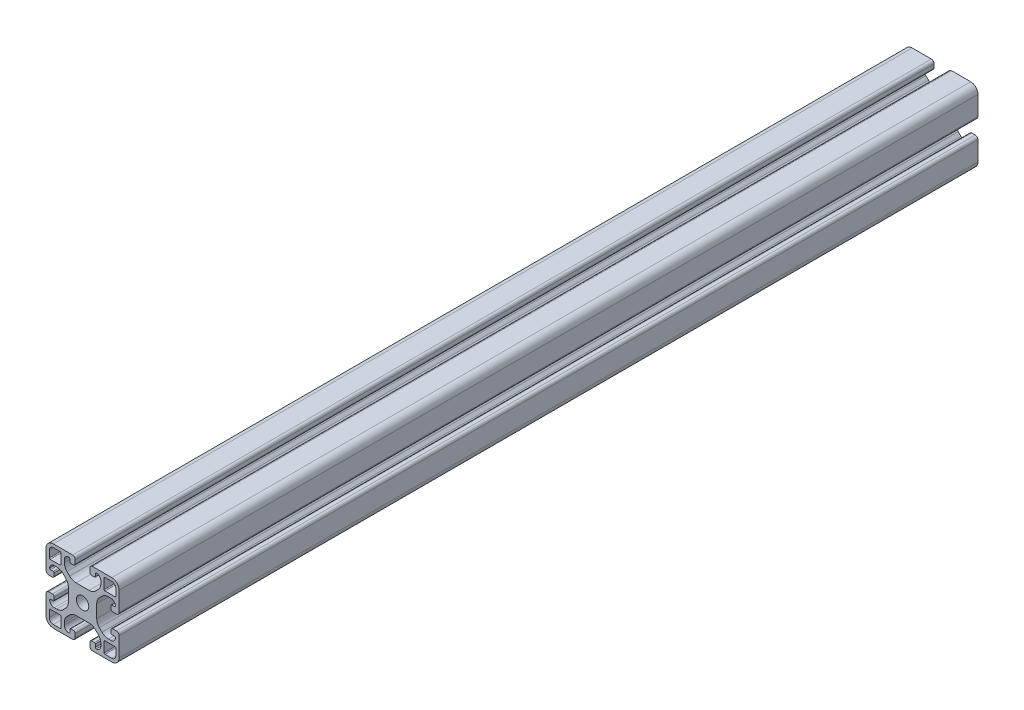
from build123d import *

# Parameters (mm, degrees)
ESQUISSE1_R        = 3.4
BOSS_EXTRU_1_DEPTH = 470


with BuildPart() as part:
    # Esquisse1 → Boss.-Extru.1 (new body)
    with BuildSketch(Plane(origin=(0, 0, -30), x_dir=(-1, 0, 0), z_dir=(0, 0, -1))):
        with BuildLine():
            Line((-4.5, 15), (-4.5, 13.5))
            ThreePointArc((-4.5, 13.5), (-4.353553391, 13.146446609), (-4, 13))
            Line((-4, 13), (-2.5, 13))
            ThreePointArc((-2.5, 13), (-2.146446609, 12.853553391), (-2, 12.5))
            ThreePointArc((-2, 12.5), (-2.732233047, 10.732233047), (-4.5, 10))
            Line((-4.5, 10), (-5.807611845, 10))
            ThreePointArc((-5.807611845, 10), (-7.721029006, 10.380602337), (-9.343145751, 11.464466094))
            Line((-9.343145751, 11.464466094), (-10.785533906, 12.906854249))
            ThreePointArc((-10.785533906, 12.906854249), (-11.869397663, 14.528970994), (-12.25, 16.442388155))
            Line((-12.25, 16.442388155), (-12.25, 23.557611845))
            ThreePointArc((-12.25, 23.557611845), (-11.869397663, 25.471029006), (-10.785533906, 27.093145751))
            Line((-10.785533906, 27.093145751), (-9.343145751, 28.535533906))
            ThreePointArc((-9.343145751, 28.535533906), (-7.721029006, 29.619397663), (-5.807611845, 30))
            Line((-5.807611845, 30), (-4.5, 30))
            ThreePointArc((-4.5, 30), (-2.732233047, 29.267766953), (-2, 27.5))
            ThreePointArc((-2, 27.5), (-2.146446609, 27.146446609), (-2.5, 27))
            Line((-2.5, 27), (-4, 27))
            ThreePointArc((-4, 27), (-4.353553391, 26.853553391), (-4.5, 26.5))
            Line((-4.5, 26.5), (-4.5, 25))
            ThreePointArc((-4.5, 25), (-4.207106781, 24.292893219), (-3.5, 24))
            Line((-3.5, 24), (-1.5, 24))
            ThreePointArc((-1.5, 24), (-0.439339828, 24.439339828), (0, 25.5))
            Line((0, 25.5), (0, 36))
            ThreePointArc((0, 36), (-1.171572875, 38.828427125), (-4, 40))
            Line((-4, 40), (-14.5, 40))
            ThreePointArc((-14.5, 40), (-15.560660172, 39.560660172), (-16, 38.5))
            Line((-16, 38.5), (-16, 36.5))
            ThreePointArc((-16, 36.5), (-15.707106781, 35.792893219), (-15, 35.5))
            Line((-15, 35.5), (-13.5, 35.5))
            ThreePointArc((-13.5, 35.5), (-13.146446609, 35.646446609), (-13, 36))
            Line((-13, 36), (-13, 37.5))
            ThreePointArc((-13, 37.5), (-12.853553391, 37.853553391), (-12.5, 38))
            ThreePointArc((-12.5, 38), (-10.732233047, 37.267766953), (-10, 35.5))
            Line((-10, 35.5), (-10, 34.192388155))
            ThreePointArc((-10, 34.192388155), (-10.380602337, 32.278970994), (-11.464466094, 30.656854249))
            Line((-11.464466094, 30.656854249), (-12.906854249, 29.214466094))
            ThreePointArc((-12.906854249, 29.214466094), (-14.528970994, 28.130602337), (-16.442388155, 27.75))
            Line((-16.442388155, 27.75), (-23.557611845, 27.75))
            ThreePointArc((-23.557611845, 27.75), (-25.471029006, 28.130602337), (-27.093145751, 29.214466094))
            Line((-27.093145751, 29.214466094), (-28.535533906, 30.656854249))
            ThreePointArc((-28.535533906, 30.656854249), (-29.619397663, 32.278970994), (-30, 34.192388155))
            Line((-30, 34.192388155), (-30, 35.5))
            ThreePointArc((-30, 35.5), (-29.267766953, 37.267766953), (-27.5, 38))
            ThreePointArc((-27.5, 38), (-27.146446609, 37.853553391), (-27, 37.5))
            Line((-27, 37.5), (-27, 36))
            ThreePointArc((-27, 36), (-26.853553391, 35.646446609), (-26.5, 35.5))
            Line((-26.5, 35.5), (-25, 35.5))
            ThreePointArc((-25, 35.5), (-24.292893219, 35.792893219), (-24, 36.5))
            Line((-24, 36.5), (-24, 38.5))
            ThreePointArc((-24, 38.5), (-24.439339828, 39.560660172), (-25.5, 40))
            Line((-25.5, 40), (-36, 40))
            ThreePointArc((-36, 40), (-38.828427125, 38.828427125), (-40, 36))
            Line((-40, 36), (-40, 25.5))
            ThreePointArc((-40, 25.5), (-39.560660172, 24.439339828), (-38.5, 24))
            Line((-38.5, 24), (-36.5, 24))
            ThreePointArc((-36.5, 24), (-35.792893219, 24.292893219), (-35.5, 25))
            Line((-35.5, 25), (-35.5, 26.5))
            ThreePointArc((-35.5, 26.5), (-35.646446609, 26.853553391), (-36, 27))
            Line((-36, 27), (-37.5, 27))
            ThreePointArc((-37.5, 27), (-37.853553391, 27.146446609), (-38, 27.5))
            ThreePointArc((-38, 27.5), (-37.267766953, 29.267766953), (-35.5, 30))
            Line((-35.5, 30), (-34.192388155, 30))
            ThreePointArc((-34.192388155, 30), (-32.278970994, 29.619397663), (-30.656854249, 28.535533906))
            Line((-30.656854249, 28.535533906), (-29.214466094, 27.093145751))
            ThreePointArc((-29.214466094, 27.093145751), (-28.130602337, 25.471029006), (-27.75, 23.557611845))
            Line((-27.75, 23.557611845), (-27.75, 16.442388155))
            ThreePointArc((-27.75, 16.442388155), (-28.130602337, 14.528970994), (-29.214466094, 12.906854249))
            Line((-29.214466094, 12.906854249), (-30.656854249, 11.464466094))
            ThreePointArc((-30.656854249, 11.464466094), (-32.278970994, 10.380602337), (-34.192388155, 10))
            Line((-34.192388155, 10), (-35.5, 10))
            ThreePointArc((-35.5, 10), (-37.267766953, 10.732233047), (-38, 12.5))
            ThreePointArc((-38, 12.5), (-37.853553391, 12.853553391), (-37.5, 13))
            Line((-37.5, 13), (-36, 13))
            ThreePointArc((-36, 13), (-35.646446609, 13.146446609), (-35.5, 13.5))
            Line((-35.5, 13.5), (-35.5, 15))
            ThreePointArc((-35.5, 15), (-35.792893219, 15.707106781), (-36.5, 16))
            Line((-36.5, 16), (-38.5, 16))
            ThreePointArc((-38.5, 16), (-39.560660172, 15.560660172), (-40, 14.5))
            Line((-40, 14.5), (-40, 4))
            ThreePointArc((-40, 4), (-38.828427125, 1.171572875), (-36, 0))
            Line((-36, 0), (-25.5, 0))
            ThreePointArc((-25.5, 0), (-24.439339828, 0.439339828), (-24, 1.5))
            Line((-24, 1.5), (-24, 3.5))
            ThreePointArc((-24, 3.5), (-24.292893219, 4.207106781), (-25, 4.5))
            Line((-25, 4.5), (-26.5, 4.5))
            ThreePointArc((-26.5, 4.5), (-26.853553391, 4.353553391), (-27, 4))
            Line((-27, 4), (-27, 2.5))
            ThreePointArc((-27, 2.5), (-27.146446609, 2.146446609), (-27.5, 2))
            ThreePointArc((-27.5, 2), (-29.267766953, 2.732233047), (-30, 4.5))
            Line((-30, 4.5), (-30, 5.807611845))
            ThreePointArc((-30, 5.807611845), (-29.619397663, 7.721029006), (-28.535533906, 9.343145751))
            Line((-28.535533906, 9.343145751), (-27.093145751, 10.785533906))
            ThreePointArc((-27.093145751, 10.785533906), (-25.471029006, 11.869397663), (-23.557611845, 12.25))
            Line((-23.557611845, 12.25), (-16.442388155, 12.25))
            ThreePointArc((-16.442388155, 12.25), (-14.528970994, 11.869397663), (-12.906854249, 10.785533906))
            Line((-12.906854249, 10.785533906), (-11.464466094, 9.343145751))
            ThreePointArc((-11.464466094, 9.343145751), (-10.380602337, 7.721029006), (-10, 5.807611845))
            Line((-10, 5.807611845), (-10, 4.5))
            ThreePointArc((-10, 4.5), (-10.732233047, 2.732233047), (-12.5, 2))
            ThreePointArc((-12.5, 2), (-12.853553391, 2.146446609), (-13, 2.5))
            Line((-13, 2.5), (-13, 4))
            ThreePointArc((-13, 4), (-13.146446609, 4.353553391), (-13.5, 4.5))
            Line((-13.5, 4.5), (-15, 4.5))
            ThreePointArc((-15, 4.5), (-15.707106781, 4.207106781), (-16, 3.5))
            Line((-16, 3.5), (-16, 1.5))
            ThreePointArc((-16, 1.5), (-15.560660172, 0.439339828), (-14.5, 0))
            Line((-14.5, 0), (-4, 0))
            ThreePointArc((-4, 0), (-1.171572875, 1.171572875), (0, 4))
            Line((0, 4), (0, 14.5))
            ThreePointArc((0, 14.5), (-0.439339828, 15.560660172), (-1.5, 16))
            Line((-1.5, 16), (-3.5, 16))
            ThreePointArc((-3.5, 16), (-4.207106781, 15.707106781), (-4.5, 15))
        make_face()
        with Locations((-20, 20)):
            Circle(ESQUISSE1_R, mode=Mode.SUBTRACT)
        with BuildLine():
            Line((-4, 1.8), (-7.7, 1.8))
            ThreePointArc((-7.7, 1.8), (-8.053553391, 1.946446609), (-8.2, 2.3))
            Line((-8.2, 2.3), (-8.2, 7.7))
            ThreePointArc((-8.2, 7.7), (-8.053553391, 8.053553391), (-7.7, 8.2))
            Line((-7.7, 8.2), (-2.3, 8.2))
            ThreePointArc((-2.3, 8.2), (-1.946446609, 8.053553391), (-1.8, 7.7))
            Line((-1.8, 7.7), (-1.8, 4))
            ThreePointArc((-1.8, 4), (-2.444365081, 2.444365081), (-4, 1.8))
        make_face(mode=Mode.SUBTRACT)
        with BuildLine():
            Line((-38.2, 4), (-38.2, 7.7))
            ThreePointArc((-38.2, 7.7), (-38.053553391, 8.053553391), (-37.7, 8.2))
            Line((-37.7, 8.2), (-32.3, 8.2))
            ThreePointArc((-32.3, 8.2), (-31.946446609, 8.053553391), (-31.8, 7.7))
            Line((-31.8, 7.7), (-31.8, 2.3))
            ThreePointArc((-31.8, 2.3), (-31.946446609, 1.946446609), (-32.3, 1.8))
            Line((-32.3, 1.8), (-36, 1.8))
            ThreePointArc((-36, 1.8), (-37.555634919, 2.444365081), (-38.2, 4))
        make_face(mode=Mode.SUBTRACT)
        with BuildLine():
            Line((-36, 38.2), (-32.3, 38.2))
            ThreePointArc((-32.3, 38.2), (-31.946446609, 38.053553391), (-31.8, 37.7))
            Line((-31.8, 37.7), (-31.8, 32.3))
            ThreePointArc((-31.8, 32.3), (-31.946446609, 31.946446609), (-32.3, 31.8))
            Line((-32.3, 31.8), (-37.7, 31.8))
            ThreePointArc((-37.7, 31.8), (-38.053553391, 31.946446609), (-38.2, 32.3))
            Line((-38.2, 32.3), (-38.2, 36))
            ThreePointArc((-38.2, 36), (-37.555634919, 37.555634919), (-36, 38.2))
        make_face(mode=Mode.SUBTRACT)
        with BuildLine():
            Line((-1.8, 36), (-1.8, 32.3))
            ThreePointArc((-1.8, 32.3), (-1.946446609, 31.946446609), (-2.3, 31.8))
            Line((-2.3, 31.8), (-7.7, 31.8))
            ThreePointArc((-7.7, 31.8), (-8.053553391, 31.946446609), (-8.2, 32.3))
            Line((-8.2, 32.3), (-8.2, 37.7))
            ThreePointArc((-8.2, 37.7), (-8.053553391, 38.053553391), (-7.7, 38.2))
            Line((-7.7, 38.2), (-4, 38.2))
            ThreePointArc((-4, 38.2), (-2.444365081, 37.555634919), (-1.8, 36))
        make_face(mode=Mode.SUBTRACT)
    extrude(amount=-BOSS_EXTRU_1_DEPTH)


solid = part.part
